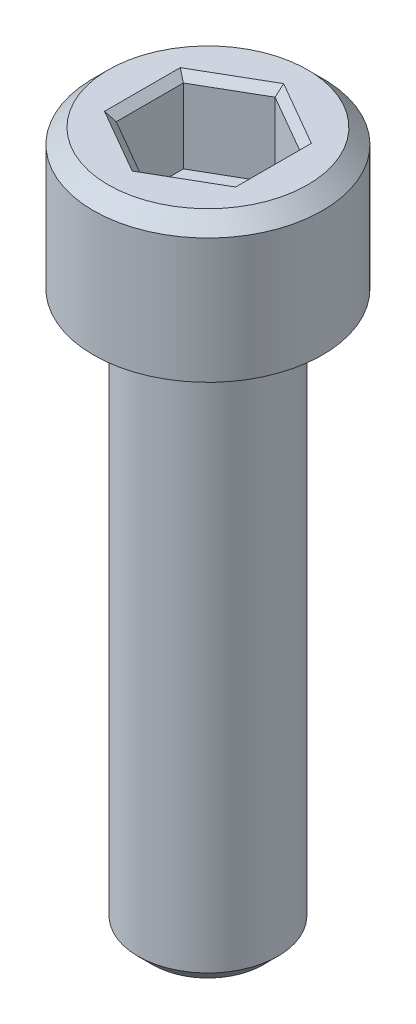
from build123d import *

# Parameters (mm, degrees)
SKETCH1_W           = 3.9116
SKETCH1_H           = 4.7752
SKETCH2_R           = 2.3876
BOSS_EXTRUDE1_DEPTH = 19.05
CUT_EXTRUDE1_DEPTH  = 2.794
CHAMFER1_SIZE       = 0.508
CHAMFER2_SIZE       = 0.254


with BuildPart() as part:
    # Sketch1 → Revolve1 (revolve)
    with BuildSketch(Plane.XY, mode=Mode.PRIVATE) as revolve1_sk:
        with Locations((-1.9558, -2.3876)):
            Rectangle(SKETCH1_W, SKETCH1_H)
    revolve(revolve1_sk.sketch.rotate(Axis((0, -4.7752, 0), (0, 1, 0)), 90), axis=Axis((0, -4.7752, 0), (0, 1, 0)))

    # Sketch2 → Boss-Extrude1 (add)
    with BuildSketch(Plane.XZ.offset(4.7752)):
        with Locations(Location((0, 0, 0), (0, 0, 90))):
            Circle(SKETCH2_R)
    extrude(amount=BOSS_EXTRUDE1_DEPTH)

    # Sketch3 → Cut-Extrude1 (cut)
    with BuildSketch(Plane(origin=(0, 0, 0), x_dir=(-1, 0, 0), z_dir=(0, 1, 0))):
        Polygon((1.984374999, -1.14567944), (1.984374999, 1.14567944), (0, 2.29135888), (-1.984374999, 1.14567944), (-1.984374999, -1.14567944), (0, -2.29135888), align=None)
    extrude(amount=-CUT_EXTRUDE1_DEPTH, mode=Mode.SUBTRACT)

    # Chamfer1
    chamfer1_edges = [part.edges().sort_by_distance(p)[0] for p in [
        (0, 0, -3.9116),
        (0, -23.8252, -2.3876),
    ]]
    chamfer(chamfer1_edges, length=CHAMFER1_SIZE)

    # Chamfer2
    chamfer2_edges = [part.edges().sort_by_distance(p)[0] for p in [
        (-0.9921875, 0, -1.71851916),
        (-1.984374999, 0, 0),
        (-0.9921875, 0, 1.71851916),
        (0.9921875, 0, 1.71851916),
        (1.984374999, 0, 0),
        (0.9921875, 0, -1.71851916),
    ]]
    chamfer(chamfer2_edges, length=CHAMFER2_SIZE)


solid = part.part
